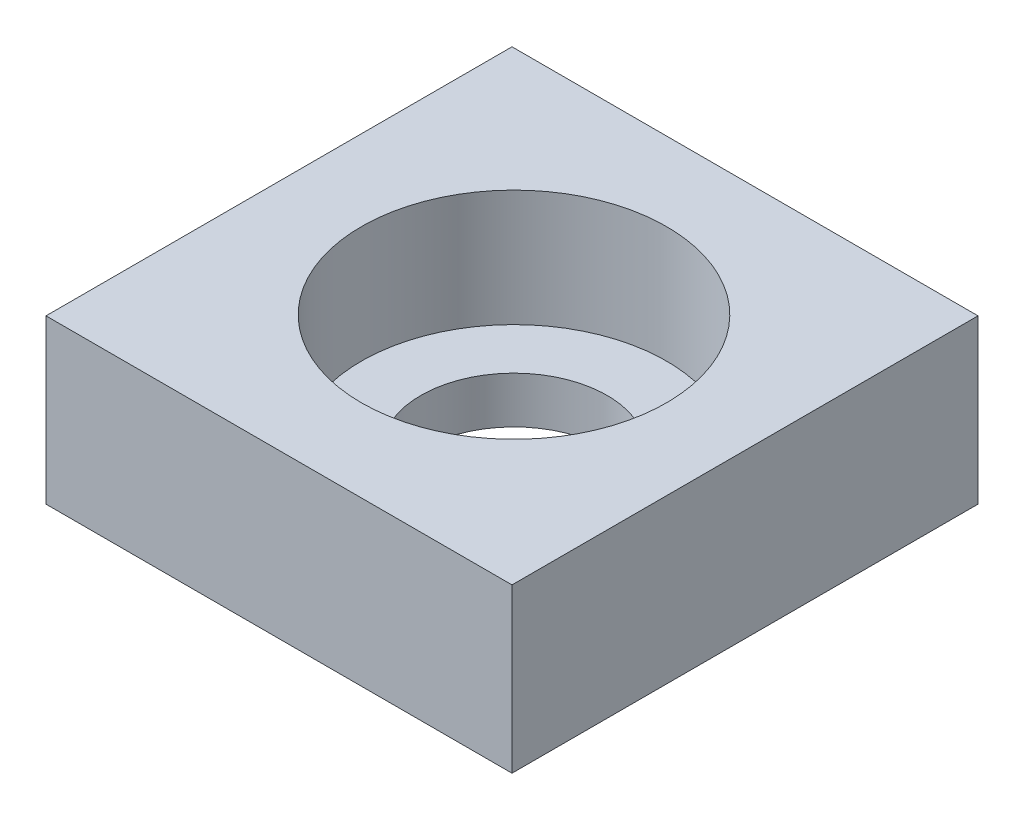
from build123d import *

# Parameters (mm, degrees)
SKETCH1_W           = 20
SKETCH1_H           = 20
BOSS_EXTRUDE1_DEPTH = 7
SKETCH2_R           = 6.55
CUT_EXTRUDE1_DEPTH  = 5
SKETCH3_R           = 4
CUT_EXTRUDE3_DEPTH  = 2


with BuildPart() as part:
    # Sketch1 → Boss-Extrude1 (new body)
    with BuildSketch(Plane(origin=(0, 0, 0), x_dir=(1, 0, 0), z_dir=(0, 1, 0))):
        with Locations((10, 10)):
            Rectangle(SKETCH1_W, SKETCH1_H)
    extrude(amount=BOSS_EXTRUDE1_DEPTH)

    # Sketch2 → Cut-Extrude1 (cut)
    with BuildSketch(Plane(origin=(0, 7, 0), x_dir=(1, 0, 0), z_dir=(0, 1, 0))):
        with Locations(Location((10, 10.085188857, 0), (0, 0, 270))):
            Circle(SKETCH2_R)
    extrude(amount=-CUT_EXTRUDE1_DEPTH, mode=Mode.SUBTRACT)

    # Sketch3 → Cut-Extrude3 (cut)
    with BuildSketch(Plane(origin=(0, 2, 0), x_dir=(1, 0, 0), z_dir=(0, 1, 0))):
        with Locations(Location((10, 10.085188857, 0), (0, 0, 270))):
            Circle(SKETCH3_R)
    extrude(amount=-CUT_EXTRUDE3_DEPTH, mode=Mode.SUBTRACT)


solid = part.part
